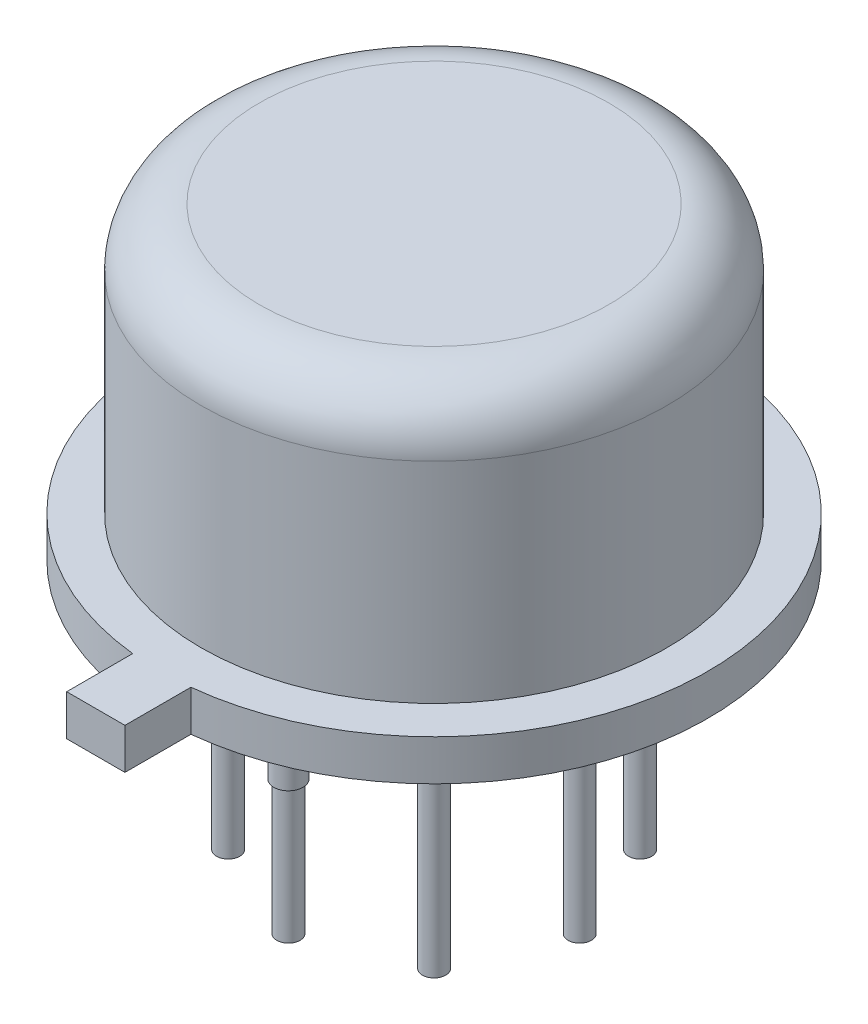
from build123d import *

# Parameters (mm, degrees)
EXTRUDE_1_DEPTH = 0.7
SKETCH_2_R      = 4
EXTRUDE_2_DEPTH = 4.6
FILLET_1_R      = 1
SKETCH_4_R      = 0.2
EXTRUDE_3_DEPTH = 4.3
SKETCH_5_R      = 0.25
EXTRUDE_4_DEPTH = 2


with BuildPart() as part:
    # Эскиз1 → Бобышка-Вытянуть1 (new body)
    with BuildSketch(Plane(origin=(0, 0, 0), x_dir=(1, 0, 0), z_dir=(0, 1, 0))):
        with BuildLine():
            Line((0, -5.806112013), (0.5, -5.806112013))
            Line((0.5, -5.806112013), (0.5, -4.673328578))
            ThreePointArc((0.5, -4.673328578), (0, 4.7), (-0.5, -4.673328578))
            Line((-0.5, -4.673328578), (-0.5, -5.806112013))
            Line((-0.5, -5.806112013), (0, -5.806112013))
        make_face()
    extrude(amount=EXTRUDE_1_DEPTH)

    # Эскиз2 → Бобышка-Вытянуть2 (add)
    with BuildSketch(Plane(origin=(0, 0.7, 0), x_dir=(1, 0, 0), z_dir=(0, 1, 0))):
        with Locations(Location((0, 0, 0), (0, 0, 270))):
            Circle(SKETCH_2_R)
    extrude(amount=EXTRUDE_2_DEPTH)

    # Скругление1
    fillet_1_edges = [part.edges().sort_by_distance(p)[0] for p in [
        (0, 5.3, -4),
    ]]
    fillet(fillet_1_edges, radius=FILLET_1_R)

    # Эскиз4 → Бобышка-Вытянуть3 (add)
    with BuildSketch(Plane.XZ):
        with Locations(Location((2.5, 0, 0), (0, 0, 90))):
            Circle(SKETCH_4_R)
        with Locations(Location((1.767766953, -1.767766953, 0), (0, 0, 90))):
            Circle(SKETCH_4_R)
        with Locations(Location((0, -2.5, 0), (0, 0, 90))):
            Circle(SKETCH_4_R)
        with Locations(Location((-1.767766953, -1.767766953, 0), (0, 0, 90))):
            Circle(SKETCH_4_R)
        with Locations(Location((-2.5, 0, 0), (0, 0, 90))):
            Circle(SKETCH_4_R)
        with Locations(Location((-1.767766953, 1.767766953, 0), (0, 0, 90))):
            Circle(SKETCH_4_R)
        with Locations(Location((0, 2.5, 0), (0, 0, 90))):
            Circle(SKETCH_4_R)
        with Locations(Location((1.767766953, 1.767766953, 0), (0, 0, 90))):
            Circle(SKETCH_4_R)
    extrude(amount=EXTRUDE_3_DEPTH)

    # Эскиз5 → Бобышка-Вытянуть4 (add)
    with BuildSketch(Plane.XZ):
        with Locations(Location((0, 2.5, 0), (0, 0, 90))):
            Circle(SKETCH_5_R)
    extrude(amount=EXTRUDE_4_DEPTH)


solid = part.part
